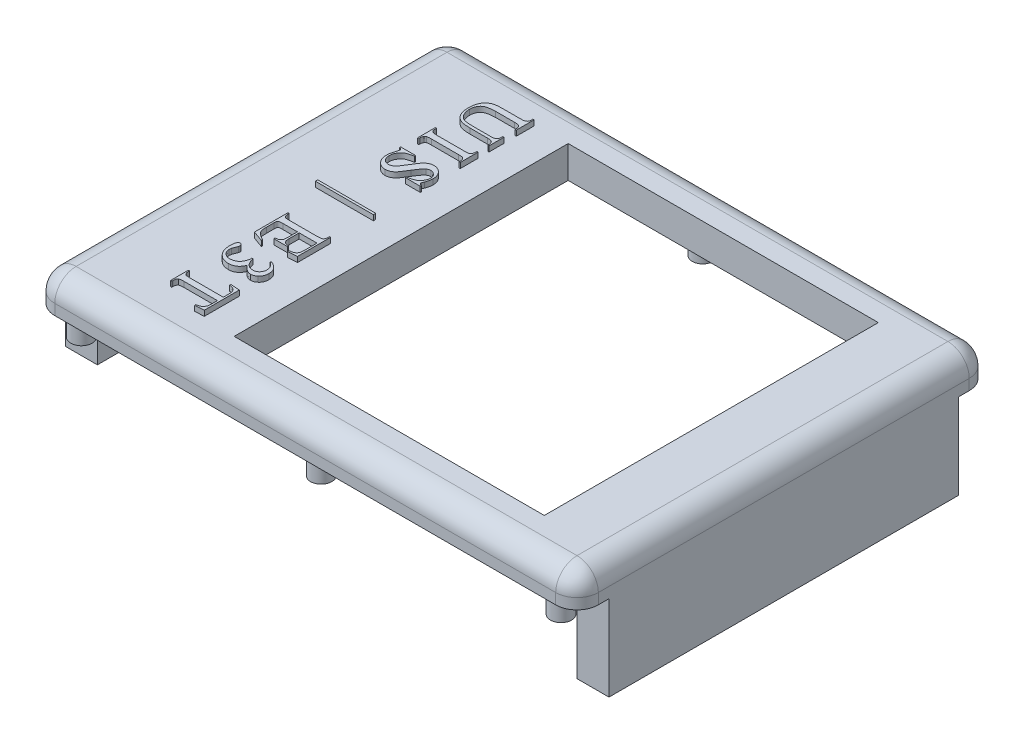
from build123d import *

# Parameters (mm, degrees)
CROQUIS1_W              = 51
CROQUIS1_H              = 38.8
SALIENTE_EXTRUIR1_DEPTH = 3
CROQUIS2_R              = 0.99
SALIENTE_EXTRUIR2_DEPTH = 2
CROQUIS5_W              = 29.1
CROQUIS5_H              = 31.34
CORTAR_EXTRUIR1_DEPTH   = 6
REDONDEO1_R             = 2
REDONDEO2_R             = 2
CROQUIS7_W              = 3
CROQUIS7_H              = 32.8
SALIENTE_EXTRUIR5_DEPTH = 8
CROQUIS9_W              = 3
CROQUIS9_H              = 32.8
SALIENTE_EXTRUIR6_DEPTH = 5
CROQUIS6_W              = 5.444444445
CROQUIS6_H              = 0.222222223
SALIENTE_EXTRUIR7_DEPTH = 0.5


with BuildPart() as part:
    # Croquis1 → Saliente-Extruir1 (new body)
    with BuildSketch(Plane(origin=(0, 0, 0), x_dir=(1, 0, 0), z_dir=(0, 1, 0))):
        with Locations((1.724460432, -10.851079137)):
            Rectangle(CROQUIS1_W, CROQUIS1_H)
    extrude(amount=SALIENTE_EXTRUIR1_DEPTH)

    # Croquis2 → Saliente-Extruir2 (add)
    with BuildSketch(Plane.XZ):
        with Locations(Location((-20.775539568, 28.751079137, 0), (0, 0, 90))):
            Circle(CROQUIS2_R)
        with Locations(Location((1.724460432, 28.751079137, 0), (0, 0, 90))):
            Circle(CROQUIS2_R)
        with Locations(Location((24.224460432, 28.751079137, 0), (0, 0, 90))):
            Circle(CROQUIS2_R)
        with Locations(Location((24.224460432, -7.048920863, 0), (0, 0, 90))):
            Circle(CROQUIS2_R)
        with Locations(Location((1.724460432, -7.048920863, 0), (0, 0, 90))):
            Circle(CROQUIS2_R)
        with Locations(Location((-20.775539568, -7.048920863, 0), (0, 0, 90))):
            Circle(CROQUIS2_R)
    extrude(amount=SALIENTE_EXTRUIR2_DEPTH)

    # Croquis5 → Cortar-Extruir1 (cut)
    with BuildSketch(Plane(origin=(0, 3, 0), x_dir=(1, 0, 0), z_dir=(0, 1, 0))):
        with Locations((5.874460432, -10.851079137)):
            Rectangle(CROQUIS5_W, CROQUIS5_H)
    extrude(amount=-CORTAR_EXTRUIR1_DEPTH, mode=Mode.SUBTRACT)

    # Redondeo1
    redondeo1_edges = [part.edges().sort_by_distance(p)[0] for p in [
        (-23.775539568, 1.5, -8.548920863),
        (27.224460432, 1.5, -8.548920863),
        (27.224460432, 1.5, 30.251079137),
        (-23.775539568, 1.5, 30.251079137),
    ]]
    fillet(redondeo1_edges, radius=REDONDEO1_R)

    # Redondeo2
    redondeo2_edges = [part.edges().sort_by_distance(p)[0] for p in [
        (1.724460432, 3, 30.251079137),
        (-23.775539568, 3, 10.851079137),
        (27.224460432, 3, 10.851079137),
        (1.724460432, 3, -8.548920863),
        (26.638673994, 3, 29.665292699),
        (26.638673994, 3, -7.963134426),
        (-23.189753131, 3, -7.963134426),
        (-23.189753131, 3, 29.665292699),
    ]]
    fillet(redondeo2_edges, radius=REDONDEO2_R)

    # Croquis7 → Saliente-Extruir5 (add)
    with BuildSketch(Plane.XZ):
        with Locations((25.724460432, 10.851079137)):
            Rectangle(CROQUIS7_W, CROQUIS7_H)
    extrude(amount=SALIENTE_EXTRUIR5_DEPTH)

    # Croquis9 → Saliente-Extruir6 (add)
    with BuildSketch(Plane.XZ):
        with Locations((-22.275539568, 10.851079137)):
            Rectangle(CROQUIS9_W, CROQUIS9_H)
    extrude(amount=SALIENTE_EXTRUIR6_DEPTH)

    # Croquis6 → Saliente-Extruir7 (add)
    with BuildSketch(Plane(origin=(0, 3, 0), x_dir=(1, 0, 0), z_dir=(0, 1, 0))):
        with BuildLine():
            Line((-11.812886434, 1.810031974), (-11.701775323, 1.810031974))
            Line((-11.701775323, 1.810031974), (-11.701775323, 0.421143086))
            Line((-11.701775323, 0.421143086), (-11.812886434, 0.421143086))
            Line((-11.812886434, 0.421143086), (-11.812886434, 0.566108363))
            add(Edge.make_bspline(
                [(-11.812886434, 0.566108363), (-11.813186826, 0.584682436), (-11.813773216, 0.620940506), (-11.824160001, 0.673232362), (-11.838466161, 0.722876431), (-11.860424884, 0.768485072), (-11.88776298, 0.811396589), (-11.921928202, 0.849946633), (-11.961236962, 0.886581508), (-11.991662382, 0.906529818), (-12.007330879, 0.916802808)],
                knots=[0, 0, 0, 0, 1.05814492, 2.065583099, 3.032120933, 3.999927837, 4.943619597, 5.927082395, 6.932487944, 8, 8, 8, 8], degree=3))
            add(Edge.make_bspline(
                [(-12.007330879, 0.916802808), (-12.015885945, 0.921702514), (-12.034867297, 0.93257362), (-12.06909909, 0.943881837), (-12.109995222, 0.954191617), (-12.158383141, 0.963121326), (-12.214465465, 0.968208496), (-12.277768335, 0.974063308), (-12.348464256, 0.97615662), (-12.397956625, 0.976511773), (-12.423997545, 0.976698641)],
                knots=[0, 0, 0, 0, 0.555635884, 1.232804023, 2.025528617, 2.939087152, 4.007474232, 5.204479969, 6.529108343, 8, 8, 8, 8], degree=3))
            Line((-12.423997545, 0.976698641), (-14.03250449, 0.976698641))
            add(Edge.make_bspline(
                [(-14.03250449, 0.976698641), (-14.080835984, 0.976897003), (-14.174646751, 0.977282019), (-14.311224421, 0.984109031), (-14.439547124, 0.992038247), (-14.559510076, 1.004822908), (-14.67080696, 1.022773258), (-14.774254396, 1.04176871), (-14.869128773, 1.066579748), (-14.957232907, 1.093794393), (-15.039253771, 1.128523641), (-15.117531157, 1.169166657), (-15.192513448, 1.217442713), (-15.265011397, 1.272314656), (-15.334309799, 1.334853337), (-15.400323735, 1.404858663), (-15.464121557, 1.48127843), (-15.523537762, 1.565629123), (-15.580129804, 1.656506087), (-15.627247332, 1.756656429), (-15.667491857, 1.864406349), (-15.699946214, 1.979767397), (-15.726445309, 2.102906691), (-15.743890155, 2.234114046), (-15.755741176, 2.373181779), (-15.756791923, 2.46857011), (-15.757330879, 2.517497252)],
                knots=[0, 0, 0, 0, 1.298907791, 2.52116217, 3.674831977, 4.754425565, 5.762003026, 6.704633784, 7.579886174, 8.39646913, 9.180785329, 9.970443218, 10.764379056, 11.574790616, 12.411857157, 13.270046324, 14.159284991, 15.085081703, 16.041440738, 17.032860088, 18.054181196, 19.12995817, 20.251108708, 21.436788606, 22.685262574, 24, 24, 24, 24], degree=3))
            add(Edge.make_bspline(
                [(-15.757330879, 2.517497252), (-15.75670387, 2.570466795), (-15.75548625, 2.673331021), (-15.744993583, 2.822558123), (-15.727924096, 2.962009634), (-15.703658724, 3.091619749), (-15.673160658, 3.211820068), (-15.633493121, 3.321494422), (-15.589065847, 3.421994145), (-15.536111231, 3.512221723), (-15.477434728, 3.594258131), (-15.413928939, 3.669783907), (-15.346059325, 3.739779783), (-15.272814878, 3.803265939), (-15.194871331, 3.86074066), (-15.111559893, 3.910764931), (-15.024943179, 3.956990929), (-14.963617999, 3.981052238), (-14.932678101, 3.993191697)],
                knots=[0, 0, 0, 0, 1.399579653, 2.717914267, 3.950818895, 5.110036753, 6.200518206, 7.223531918, 8.188553587, 9.099986203, 9.982611596, 10.850979964, 11.705298224, 12.556222305, 13.409581964, 14.260643446, 15.122456467, 16, 16, 16, 16], degree=3))
            add(Edge.make_bspline(
                [(-14.932678101, 3.993191697), (-14.908781507, 4.001138469), (-14.85702154, 4.018351161), (-14.77055747, 4.036552634), (-14.670465641, 4.05151946), (-14.556494723, 4.065810468), (-14.428179272, 4.075782279), (-14.285743758, 4.082352883), (-14.129174745, 4.086751631), (-14.020065562, 4.087446637), (-13.963060045, 4.087809752)],
                knots=[0, 0, 0, 0, 0.617665381, 1.337861774, 2.164475126, 3.101682011, 4.156149986, 5.322177338, 6.600936584, 8, 8, 8, 8], degree=3))
            Line((-13.963060045, 4.087809752), (-12.423997545, 4.087809752))
            add(Edge.make_bspline(
                [(-12.423997545, 4.087809752), (-12.393902201, 4.088203816), (-12.336571878, 4.088954492), (-12.254554348, 4.092906147), (-12.180740282, 4.100949374), (-12.114740981, 4.110637121), (-12.057080981, 4.124764711), (-12.007076859, 4.14077708), (-11.965157761, 4.160430443), (-11.920114073, 4.191123605), (-11.875091729, 4.240301848), (-11.838717671, 4.31443596), (-11.815628814, 4.402122175), (-11.81383855, 4.465540366), (-11.812886434, 4.499268086)],
                knots=[0, 0, 0, 0, 1.264600634, 2.409009288, 3.448162534, 4.38356954, 5.209197542, 5.939652373, 6.586739936, 7.146507456, 8.221936937, 9.341999935, 10.586394876, 12, 12, 12, 12], degree=3))
            Line((-11.812886434, 4.499268086), (-11.812886434, 4.643365308))
            Line((-11.812886434, 4.643365308), (-11.701775323, 4.643365308))
            Line((-11.701775323, 4.643365308), (-11.701775323, 2.976698641))
            Line((-11.701775323, 2.976698641), (-11.812886434, 2.976698641))
            Line((-11.812886434, 2.976698641), (-11.812886434, 3.12340003))
            add(Edge.make_bspline(
                [(-11.812886434, 3.12340003), (-11.813463018, 3.142508077), (-11.814576514, 3.179409449), (-11.820938891, 3.232901798), (-11.834476961, 3.281591402), (-11.85140099, 3.326581905), (-11.874713279, 3.366654004), (-11.901105169, 3.403993402), (-11.934996865, 3.435170201), (-11.959972745, 3.452947649), (-11.972608656, 3.461941697)],
                knots=[0, 0, 0, 0, 1.171077632, 2.261579725, 3.289188532, 4.26020492, 5.196798699, 6.122086454, 7.049917378, 8, 8, 8, 8], degree=3))
            add(Edge.make_bspline(
                [(-11.972608656, 3.461941697), (-11.982580013, 3.467770883), (-12.004273941, 3.480453006), (-12.043309034, 3.493473318), (-12.088868081, 3.505338694), (-12.141840633, 3.516068174), (-12.201912901, 3.523414319), (-12.269419749, 3.52834071), (-12.344095264, 3.532082651), (-12.396503735, 3.532195169), (-12.423997545, 3.532254197)],
                knots=[0, 0, 0, 0, 0.599365068, 1.303993416, 2.129008853, 3.049898852, 4.112078821, 5.274450609, 6.570159807, 8, 8, 8, 8], degree=3))
            Line((-12.423997545, 3.532254197), (-14.186150323, 3.532254197))
            add(Edge.make_bspline(
                [(-14.186150323, 3.532254197), (-14.226668765, 3.53169017), (-14.310956749, 3.53051686), (-14.441586787, 3.522570209), (-14.581052159, 3.50810662), (-14.724771258, 3.489901207), (-14.865275469, 3.467136631), (-14.992386049, 3.43203818), (-15.104109374, 3.390503331), (-15.200307588, 3.337403875), (-15.283405272, 3.273082194), (-15.358737501, 3.198533233), (-15.423831093, 3.109759078), (-15.483539662, 3.010833396), (-15.532907015, 2.899321805), (-15.565690697, 2.774495879), (-15.587181451, 2.638321221), (-15.589474507, 2.543339193), (-15.590664212, 2.494059752)],
                knots=[0, 0, 0, 0, 0.967473696, 2.012575106, 3.123518964, 4.3146852, 5.472133772, 6.518011343, 7.458490451, 8.312073185, 9.130133735, 9.960644692, 10.833935845, 11.751030991, 12.716306638, 13.733705286, 14.824180354, 16, 16, 16, 16], degree=3))
            add(Edge.make_bspline(
                [(-15.590664212, 2.494059752), (-15.588935587, 2.430238763), (-15.585548041, 2.305170273), (-15.550843602, 2.123064547), (-15.497792044, 1.950806443), (-15.434113707, 1.816899308), (-15.374492168, 1.717775601), (-15.326105541, 1.649735536), (-15.276399659, 1.586729079), (-15.221719811, 1.531021848), (-15.165033333, 1.480443201), (-15.104294963, 1.43716779), (-15.041993912, 1.398128943), (-14.974119322, 1.366706609), (-14.899485948, 1.338764947), (-14.813692281, 1.317295062), (-14.716821517, 1.296878448), (-14.607938727, 1.282296817), (-14.487912033, 1.268643185), (-14.356086034, 1.260724776), (-14.212527878, 1.255329794), (-14.112950451, 1.254768437), (-14.061150323, 1.254476419)],
                knots=[0, 0, 0, 0, 1.676960123, 3.286299276, 4.85821677, 6.407340885, 7.172260227, 7.898684432, 8.602383884, 9.280595474, 9.949345183, 10.597909685, 11.240146138, 11.880214089, 12.561706302, 13.333411656, 14.20365876, 15.164876295, 16.221412891, 17.380821135, 18.637504446, 20, 20, 20, 20], degree=3))
            Line((-14.061150323, 1.254476419), (-12.423997545, 1.254476419))
            add(Edge.make_bspline(
                [(-12.423997545, 1.254476419), (-12.393606064, 1.254435655), (-12.335969744, 1.254358348), (-12.253795598, 1.259335276), (-12.180458704, 1.264783183), (-12.116093404, 1.273293016), (-12.060572326, 1.284385536), (-12.014244927, 1.298206252), (-11.975278186, 1.312798363), (-11.955014221, 1.327554278), (-11.945698934, 1.33433753)],
                knots=[0, 0, 0, 0, 1.484107705, 2.814555366, 4.019988359, 5.075390106, 5.984573864, 6.780592097, 7.4394417, 8, 8, 8, 8], degree=3))
            add(Edge.make_bspline(
                [(-11.945698934, 1.33433753), (-11.925160043, 1.354244263), (-11.883871014, 1.394262474), (-11.841804157, 1.473183458), (-11.817547656, 1.564950075), (-11.814497191, 1.630469849), (-11.812886434, 1.665066697)],
                knots=[0, 0, 0, 0, 0.928124107, 1.865794122, 2.873060895, 4, 4, 4, 4], degree=3))
            Line((-11.812886434, 1.665066697), (-11.812886434, 1.810031974))
        make_face()
        with BuildLine():
            Line((-15.590664212, -2.278856914), (-15.701775323, -2.278856914))
            Line((-15.701775323, -2.278856914), (-15.701775323, -0.612190248))
            Line((-15.701775323, -0.612190248), (-15.590664212, -0.612190248))
            Line((-15.590664212, -0.612190248), (-15.590664212, -0.749343026))
            add(Edge.make_bspline(
                [(-15.590664212, -0.749343026), (-15.589063181, -0.78690475), (-15.586045477, -0.857703007), (-15.557520268, -0.955705429), (-15.51206225, -1.039592459), (-15.465868711, -1.079496343), (-15.443094767, -1.099169414)],
                knots=[0, 0, 0, 0, 1.142072474, 2.152636554, 3.089228675, 4, 4, 4, 4], degree=3))
            add(Edge.make_bspline(
                [(-15.443094767, -1.099169414), (-15.433708301, -1.104988365), (-15.413243006, -1.117675412), (-15.37575995, -1.131013792), (-15.330312737, -1.141917676), (-15.276350524, -1.151239207), (-15.21409938, -1.159093775), (-15.143380714, -1.163799677), (-15.064374111, -1.167591994), (-15.008783422, -1.167692799), (-14.979553101, -1.167745803)],
                knots=[0, 0, 0, 0, 0.558477324, 1.217647012, 2.003767936, 2.927281204, 3.991475019, 5.182702724, 6.518627757, 8, 8, 8, 8], degree=3))
            Line((-14.979553101, -1.167745803), (-12.423997545, -1.167745803))
            add(Edge.make_bspline(
                [(-12.423997545, -1.167745803), (-12.399401028, -1.16753647), (-12.352227734, -1.167134992), (-12.284517706, -1.165290643), (-12.22311835, -1.163128637), (-12.168430676, -1.158621809), (-12.120658025, -1.153504469), (-12.079418945, -1.147742315), (-12.044605231, -1.140072808), (-12.023786022, -1.133446477), (-12.014275323, -1.130419414)],
                knots=[0, 0, 0, 0, 1.429813016, 2.742217149, 3.937514499, 5.000517028, 5.931114638, 6.730382289, 7.42000908, 8, 8, 8, 8], degree=3))
            add(Edge.make_bspline(
                [(-12.014275323, -1.130419414), (-12.001838149, -1.12482765), (-11.976740194, -1.113543585), (-11.943171747, -1.086835184), (-11.911512072, -1.053781979), (-11.894063383, -1.027159533), (-11.884935045, -1.013231914)],
                knots=[0, 0, 0, 0, 0.918337523, 1.853185807, 2.876887247, 4, 4, 4, 4], degree=3))
            add(Edge.make_bspline(
                [(-11.884935045, -1.013231914), (-11.873906325, -0.99237502), (-11.851993836, -0.950935354), (-11.830287295, -0.884934703), (-11.814993344, -0.817749656), (-11.813593178, -0.772289414), (-11.812886434, -0.749343026)],
                knots=[0, 0, 0, 0, 1.022081657, 2.030730122, 3.00599665, 4, 4, 4, 4], degree=3))
            Line((-11.812886434, -0.749343026), (-11.812886434, -0.612190248))
            Line((-11.812886434, -0.612190248), (-11.701775323, -0.612190248))
            Line((-11.701775323, -0.612190248), (-11.701775323, -2.278856914))
            Line((-11.701775323, -2.278856914), (-11.812886434, -2.278856914))
            Line((-11.812886434, -2.278856914), (-11.812886434, -2.13909997))
            add(Edge.make_bspline(
                [(-11.812886434, -2.13909997), (-11.814623781, -2.102167354), (-11.817892482, -2.032681135), (-11.844659865, -1.935609651), (-11.892225937, -1.854087171), (-11.937837425, -1.814241256), (-11.960455879, -1.794481914)],
                knots=[0, 0, 0, 0, 1.13807004, 2.141201847, 3.078233522, 4, 4, 4, 4], degree=3))
            add(Edge.make_bspline(
                [(-11.960455879, -1.794481914), (-11.969865278, -1.788718388), (-11.990470921, -1.776096841), (-12.027679718, -1.761619015), (-12.073223665, -1.750076901), (-12.127026916, -1.739211559), (-12.189588981, -1.733541354), (-12.260099371, -1.726746871), (-12.339190532, -1.723603208), (-12.394772048, -1.72340538), (-12.423997545, -1.723301359)],
                knots=[0, 0, 0, 0, 0.557698212, 1.221303328, 2.010007703, 2.934903542, 3.995895676, 5.186633038, 6.520694369, 8, 8, 8, 8], degree=3))
            Line((-12.423997545, -1.723301359), (-14.979553101, -1.723301359))
            add(Edge.make_bspline(
                [(-14.979553101, -1.723301359), (-15.004149741, -1.723509263), (-15.051323273, -1.723907998), (-15.119031681, -1.725771066), (-15.18014803, -1.727861667), (-15.234819465, -1.732540871), (-15.282610703, -1.737472896), (-15.324131045, -1.743311166), (-15.35894554, -1.750973145), (-15.379764663, -1.757600306), (-15.389275323, -1.760627748)],
                knots=[0, 0, 0, 0, 1.429820858, 2.742232189, 3.937536094, 4.983777767, 5.931103291, 6.730375326, 7.420005899, 8, 8, 8, 8], degree=3))
            add(Edge.make_bspline(
                [(-15.389275323, -1.760627748), (-15.401694107, -1.766236835), (-15.426754953, -1.777555856), (-15.460952791, -1.80425406), (-15.491713719, -1.839073798), (-15.509414798, -1.866278662), (-15.518615601, -1.880419414)],
                knots=[0, 0, 0, 0, 0.908166185, 1.83266026, 2.873443546, 4, 4, 4, 4], degree=3))
            add(Edge.make_bspline(
                [(-15.518615601, -1.880419414), (-15.5296372, -1.900692411), (-15.551518325, -1.940940291), (-15.573393411, -2.005477126), (-15.588538829, -2.071557836), (-15.589951274, -2.116443655), (-15.590664212, -2.13909997)],
                knots=[0, 0, 0, 0, 1.017684848, 2.020404712, 3.000790585, 4, 4, 4, 4], degree=3))
            Line((-15.590664212, -2.13909997), (-15.590664212, -2.278856914))
        make_face()
        with BuildLine():
            Line((-11.646219767, -6.089968026), (-13.035108656, -6.089968026))
            Line((-13.035108656, -6.089968026), (-13.035108656, -5.978856914))
            add(Edge.make_bspline(
                [(-13.035108656, -5.978856914), (-12.967846536, -5.969869021), (-12.839878016, -5.952769241), (-12.659338495, -5.915199317), (-12.500529127, -5.867001413), (-12.361144714, -5.808592138), (-12.239299372, -5.737485081), (-12.132231567, -5.652942079), (-12.037590758, -5.556262355), (-11.958090794, -5.44686237), (-11.894780785, -5.329760833), (-11.8464991, -5.209560505), (-11.818947868, -5.086285746), (-11.814902356, -5.00357801), (-11.812886434, -4.962363859)],
                knots=[0, 0, 0, 0, 1.39142573, 2.647235773, 3.777217868, 4.790166756, 5.739721597, 6.660947591, 7.57997301, 8.505774658, 9.424550985, 10.303925409, 11.154827868, 12, 12, 12, 12], degree=3))
            add(Edge.make_bspline(
                [(-11.812886434, -4.962363859), (-11.813211313, -4.939464032), (-11.813851762, -4.894320469), (-11.824135008, -4.828453185), (-11.838604106, -4.765267605), (-11.859427472, -4.705247819), (-11.886660928, -4.648277758), (-11.919729737, -4.594614104), (-11.958276799, -4.543342403), (-12.017472206, -4.481754623), (-12.097818402, -4.414469735), (-12.204446389, -4.354998769), (-12.318627861, -4.318344964), (-12.397404029, -4.314249662), (-12.437018379, -4.312190248)],
                knots=[0, 0, 0, 0, 0.823190787, 1.622796809, 2.393120433, 3.153812862, 3.903666924, 4.660859271, 5.418910275, 6.207043985, 7.730921109, 9.171105095, 10.577427236, 12, 12, 12, 12], degree=3))
            add(Edge.make_bspline(
                [(-12.437018379, -4.312190248), (-12.467561857, -4.313350677), (-12.52772166, -4.315636309), (-12.615333157, -4.339269485), (-12.699773256, -4.373839487), (-12.750085125, -4.40898035), (-12.775560045, -4.426773581)],
                knots=[0, 0, 0, 0, 1.005601748, 1.980678245, 2.977536257, 4, 4, 4, 4], degree=3))
            add(Edge.make_bspline(
                [(-12.775560045, -4.426773581), (-12.795239537, -4.442648872), (-12.838026758, -4.477164985), (-12.900724207, -4.540739255), (-12.969637588, -4.616818102), (-13.040962666, -4.708917996), (-13.118527036, -4.814071395), (-13.200542677, -4.93376974), (-13.28738518, -5.067484999), (-13.345238258, -5.162159426), (-13.375386434, -5.211495803)],
                knots=[0, 0, 0, 0, 0.611101905, 1.328659962, 2.156268474, 3.09294578, 4.144138902, 5.3166236, 6.60164907, 8, 8, 8, 8], degree=3))
            add(Edge.make_bspline(
                [(-13.375386434, -5.211495803), (-13.39993675, -5.252032226), (-13.447367547, -5.330347914), (-13.516604281, -5.443038276), (-13.58157127, -5.546435807), (-13.642673546, -5.64007475), (-13.698115633, -5.725408273), (-13.748992452, -5.801753744), (-13.795950374, -5.868353181), (-13.850791286, -5.94467664), (-13.919316494, -6.028828321), (-14.009833046, -6.116497051), (-14.10724041, -6.192349523), (-14.211138128, -6.25573828), (-14.319935228, -6.305393907), (-14.431796685, -6.341110057), (-14.54632806, -6.364023975), (-14.623833482, -6.366502494), (-14.662712823, -6.367745803)],
                knots=[0, 0, 0, 0, 1.248564963, 2.412206562, 3.484516376, 4.465640353, 5.357921181, 6.165592113, 6.882544305, 7.504670364, 8.641790332, 9.736174339, 10.817308786, 11.888072917, 12.935378102, 13.959992044, 14.976663013, 16, 16, 16, 16], degree=3))
            add(Edge.make_bspline(
                [(-14.662712823, -6.367745803), (-14.699527725, -6.366857645), (-14.772094558, -6.365106974), (-14.878546823, -6.347853509), (-14.980955226, -6.32094912), (-15.079543103, -6.283296716), (-15.174881643, -6.235367153), (-15.266015472, -6.175968633), (-15.353416117, -6.106102981), (-15.435268688, -6.025700013), (-15.510024129, -5.936922379), (-15.577059246, -5.841927382), (-15.632367842, -5.739637538), (-15.678587607, -5.631931695), (-15.714501782, -5.517972786), (-15.739381666, -5.397867085), (-15.754267305, -5.271477206), (-15.756295794, -5.185205472), (-15.757330879, -5.141183303)],
                knots=[0, 0, 0, 0, 0.963147794, 1.898486258, 2.815390311, 3.731292419, 4.656172952, 5.603823843, 6.573947296, 7.581047086, 8.602405402, 9.609020728, 10.619278069, 11.640833019, 12.673450854, 13.741688496, 14.847643762, 16, 16, 16, 16], degree=3))
            add(Edge.make_bspline(
                [(-15.757330879, -5.141183303), (-15.756145175, -5.086402284), (-15.753835287, -4.979682497), (-15.738669938, -4.874027477), (-15.731289212, -4.822606914)],
                knots=[0, 0, 0, 0, 1.026632861, 2, 2, 2, 2], degree=3))
            add(Edge.make_bspline(
                [(-15.731289212, -4.822606914), (-15.729569602, -4.81421241), (-15.725708582, -4.795364334), (-15.718854133, -4.764018111), (-15.709174133, -4.726707254), (-15.696927552, -4.683697883), (-15.682957464, -4.634447403), (-15.666679049, -4.579400173), (-15.647363477, -4.518409129), (-15.626336194, -4.453658027), (-15.604860817, -4.389134464), (-15.587000199, -4.32844883), (-15.571196741, -4.274392082), (-15.557978766, -4.227050981), (-15.548405968, -4.185868852), (-15.541381528, -4.151150197), (-15.536700367, -4.122778819), (-15.535586531, -4.105893128), (-15.535108656, -4.098648581)],
                knots=[0, 0, 0, 0, 0.54761179, 1.229545953, 2.05028691, 3.010423316, 4.087386644, 5.321895787, 6.678726042, 8.175741249, 9.672756456, 11.024157601, 12.217972098, 13.272151859, 14.164739674, 14.919049308, 15.53623463, 16, 16, 16, 16], degree=3))
            add(Edge.make_bspline(
                [(-15.535108656, -4.098648581), (-15.535579966, -4.08732319), (-15.536486721, -4.065534248), (-15.544261643, -4.034305521), (-15.558395688, -4.007152117), (-15.578431967, -3.982747715), (-15.6083342, -3.963712361), (-15.647470224, -3.945844127), (-15.698735676, -3.933224614), (-15.73674892, -3.926786969), (-15.757330879, -3.923301359)],
                knots=[0, 0, 0, 0, 0.858084681, 1.650870771, 2.416167262, 3.163326943, 4.015220049, 5.07550074, 6.416553863, 8, 8, 8, 8], degree=3))
            Line((-15.757330879, -3.923301359), (-15.757330879, -3.812190248))
            Line((-15.757330879, -3.812190248), (-14.36844199, -3.812190248))
            Line((-14.36844199, -3.812190248), (-14.36844199, -3.923301359))
            add(Edge.make_bspline(
                [(-14.36844199, -3.923301359), (-14.405817035, -3.929405302), (-14.478143462, -3.941217365), (-14.582450565, -3.96265606), (-14.679796237, -3.983407579), (-14.76923535, -4.008390012), (-14.851990766, -4.033095413), (-14.927603816, -4.060039337), (-14.996208657, -4.088292337), (-15.077280248, -4.1288736), (-15.170825832, -4.187773265), (-15.271648936, -4.275281372), (-15.362658534, -4.379166511), (-15.442569973, -4.497053481), (-15.508393847, -4.626027415), (-15.555539537, -4.763349231), (-15.58540369, -4.906678225), (-15.588896724, -5.00475203), (-15.590664212, -5.054377748)],
                knots=[0, 0, 0, 0, 0.984182084, 1.904542815, 2.767594021, 3.570341986, 4.31735939, 5.011959232, 5.655849932, 6.244440382, 7.36692079, 8.518747489, 9.701680121, 10.946991771, 12.211638285, 13.453174393, 14.711296577, 16, 16, 16, 16], degree=3))
            add(Edge.make_bspline(
                [(-15.590664212, -5.054377748), (-15.589863756, -5.082751157), (-15.588299942, -5.138183035), (-15.57999996, -5.219314275), (-15.564231811, -5.295979319), (-15.542480823, -5.367922382), (-15.515784507, -5.435801569), (-15.481473183, -5.498390316), (-15.441730024, -5.556905811), (-15.395392125, -5.60959063), (-15.345702718, -5.656996831), (-15.292745108, -5.698007362), (-15.238650067, -5.734415012), (-15.180450645, -5.761471271), (-15.12162986, -5.784832371), (-15.060028698, -5.800191089), (-14.996368341, -5.810106886), (-14.952970862, -5.811488786), (-14.93094199, -5.812190248)],
                knots=[0, 0, 0, 0, 1.212040469, 2.367909939, 3.477883232, 4.549069953, 5.57481445, 6.586694365, 7.591000223, 8.589587838, 9.577335541, 10.519182355, 11.448049943, 12.354451666, 13.254089103, 14.147253018, 15.05953235, 16, 16, 16, 16], degree=3))
            add(Edge.make_bspline(
                [(-14.93094199, -5.812190248), (-14.905968231, -5.811524736), (-14.85558038, -5.810181977), (-14.780532782, -5.793612307), (-14.704348652, -5.771947591), (-14.628954522, -5.7381511), (-14.5539682, -5.695920237), (-14.482059671, -5.642501443), (-14.412621753, -5.579307611), (-14.370309537, -5.531370121), (-14.348476712, -5.506634692)],
                knots=[0, 0, 0, 0, 0.880861666, 1.777254614, 2.705733056, 3.676491508, 4.688590632, 5.741847226, 6.83480806, 8, 8, 8, 8], degree=3))
            add(Edge.make_bspline(
                [(-14.348476712, -5.506634692), (-14.339987577, -5.496002353), (-14.320372663, -5.471435374), (-14.289559486, -5.427473745), (-14.251132359, -5.373339019), (-14.208120248, -5.306889334), (-14.158284166, -5.22956841), (-14.103369092, -5.140330372), (-14.04136703, -5.04044343), (-13.975628003, -4.931904477), (-13.908155371, -4.821695886), (-13.843148923, -4.715079737), (-13.780565301, -4.616823508), (-13.72252521, -4.524933932), (-13.666993998, -4.441376617), (-13.615688289, -4.364561378), (-13.568160029, -4.295248482), (-13.510054049, -4.213703498), (-13.437292672, -4.122968423), (-13.346918334, -4.025248014), (-13.249227542, -3.944319567), (-13.148607075, -3.875785479), (-13.042453316, -3.821605425), (-12.930554212, -3.784743527), (-12.813873781, -3.761092194), (-12.734297377, -3.758134066), (-12.693962823, -3.756634692)],
                knots=[0, 0, 0, 0, 0.389670496, 0.900368887, 1.537327681, 2.291397621, 3.167445765, 4.172602766, 5.292873819, 6.535337192, 7.807662738, 8.994725359, 10.112356069, 11.144792405, 12.10806384, 12.986266124, 13.790981069, 14.515592038, 15.854128484, 17.120635582, 18.320965422, 19.479645839, 20.602856919, 21.722115554, 22.845418386, 24, 24, 24, 24], degree=3))
            add(Edge.make_bspline(
                [(-12.693962823, -3.756634692), (-12.658900145, -3.757683502), (-12.589619912, -3.759755841), (-12.487465827, -3.774811394), (-12.388983283, -3.799770726), (-12.294692566, -3.836013817), (-12.203669516, -3.881169348), (-12.116849433, -3.937365361), (-12.032935057, -4.002460055), (-11.954770386, -4.078056499), (-11.882015084, -4.160083829), (-11.819491917, -4.249681002), (-11.765017165, -4.343337654), (-11.721500967, -4.44335456), (-11.687606065, -4.54892522), (-11.663339518, -4.659936862), (-11.649498748, -4.776540376), (-11.647329041, -4.855846173), (-11.646219767, -4.896391637)],
                knots=[0, 0, 0, 0, 0.975062147, 1.926622126, 2.865572658, 3.795337113, 4.731177957, 5.686745952, 6.667240611, 7.680517841, 8.707195514, 9.712063125, 10.714348853, 11.716246724, 12.739448301, 13.794013663, 14.87217904, 16, 16, 16, 16], degree=3))
            add(Edge.make_bspline(
                [(-11.646219767, -4.896391637), (-11.648226721, -4.948873556), (-11.652333422, -5.05626398), (-11.681372211, -5.219347638), (-11.729362511, -5.386706492), (-11.774212594, -5.496886993), (-11.797261434, -5.553509692)],
                knots=[0, 0, 0, 0, 0.927627064, 1.898144454, 2.919838524, 4, 4, 4, 4], degree=3))
            add(Edge.make_bspline(
                [(-11.797261434, -5.553509692), (-11.808086507, -5.578245949), (-11.827761139, -5.623204239), (-11.849026289, -5.6863778), (-11.864984751, -5.737067149), (-11.867410027, -5.767844418), (-11.86844199, -5.780940248)],
                knots=[0, 0, 0, 0, 1.351879575, 2.457048934, 3.343469241, 4, 4, 4, 4], degree=3))
            add(Edge.make_bspline(
                [(-11.86844199, -5.780940248), (-11.868080047, -5.792873226), (-11.867380654, -5.815931623), (-11.857999358, -5.848749822), (-11.844458435, -5.87843765), (-11.824240186, -5.905355553), (-11.794863214, -5.928611926), (-11.755031792, -5.947863425), (-11.704545661, -5.965212299), (-11.66686821, -5.974026469), (-11.646219767, -5.978856914)],
                knots=[0, 0, 0, 0, 0.868125657, 1.677501313, 2.471018957, 3.239701785, 4.110392073, 5.177601582, 6.453235832, 8, 8, 8, 8], degree=3))
            Line((-11.646219767, -5.978856914), (-11.646219767, -6.089968026))
        make_face()
        with Locations((-14.257330878, -10.489968026)):
            Rectangle(CROQUIS6_W, CROQUIS6_H)
        with BuildLine():
            Line((-11.86844199, -15.556634692), (-13.535108656, -15.556634692))
            Line((-13.535108656, -15.556634692), (-13.535108656, -16.501079137))
            add(Edge.make_bspline(
                [(-13.535108656, -16.501079137), (-13.534724893, -16.52770536), (-13.533990199, -16.578679758), (-13.529861788, -16.651705888), (-13.522459056, -16.717600817), (-13.510746847, -16.776628053), (-13.497493296, -16.829053895), (-13.481054048, -16.87487257), (-13.461539574, -16.913962814), (-13.444331679, -16.935353534), (-13.436150323, -16.945523581)],
                knots=[0, 0, 0, 0, 1.378536541, 2.639130306, 3.785607632, 4.808023544, 5.752749077, 6.582109099, 7.325875096, 8, 8, 8, 8], degree=3))
            add(Edge.make_bspline(
                [(-13.436150323, -16.945523581), (-13.424685041, -16.957841054), (-13.401473171, -16.982778214), (-13.358129582, -17.012623444), (-13.31092534, -17.041135497), (-13.256103142, -17.062908722), (-13.196070139, -17.082852444), (-13.129077689, -17.095231265), (-13.056631339, -17.107804466), (-13.005945343, -17.110688519), (-12.979553101, -17.112190248)],
                knots=[0, 0, 0, 0, 0.807279986, 1.634366921, 2.520296536, 3.456336839, 4.464656133, 5.55960839, 6.72928595, 8, 8, 8, 8], degree=3))
            Line((-12.979553101, -17.112190248), (-12.979553101, -17.223301359))
            Line((-12.979553101, -17.223301359), (-14.257330879, -17.223301359))
            Line((-14.257330879, -17.223301359), (-14.257330879, -17.112190248))
            add(Edge.make_bspline(
                [(-14.257330879, -17.112190248), (-14.215898167, -17.105835634), (-14.140916746, -17.094335591), (-14.041123595, -17.074960293), (-13.965543658, -17.055456294), (-13.925035621, -17.038454719), (-13.908372545, -17.031461081)],
                knots=[0, 0, 0, 0, 1.400091839, 2.533767946, 3.396862008, 4, 4, 4, 4], degree=3))
            add(Edge.make_bspline(
                [(-13.908372545, -17.031461081), (-13.892563612, -17.022255289), (-13.860773248, -17.003743257), (-13.820939767, -16.963707496), (-13.784587397, -16.917664056), (-13.754710618, -16.860915954), (-13.729909691, -16.792529752), (-13.713506425, -16.708907416), (-13.703425747, -16.610126641), (-13.702349457, -16.539013595), (-13.701775323, -16.501079137)],
                knots=[0, 0, 0, 0, 0.730144536, 1.46825602, 2.245237048, 3.075344244, 4.025392287, 5.151105914, 6.480289368, 8, 8, 8, 8], degree=3))
            Line((-13.701775323, -16.501079137), (-13.701775323, -15.556634692))
            Line((-13.701775323, -15.556634692), (-15.069830879, -15.556634692))
            add(Edge.make_bspline(
                [(-15.069830879, -15.556634692), (-15.091535032, -15.556453417), (-15.132926128, -15.556107715), (-15.191647365, -15.558424881), (-15.243758314, -15.559756156), (-15.288917824, -15.562331207), (-15.327440182, -15.565715818), (-15.359323587, -15.569895945), (-15.384704666, -15.574689492), (-15.419106306, -15.586136032), (-15.462027175, -15.613856118), (-15.498611397, -15.659335456), (-15.51757265, -15.709838593), (-15.528210177, -15.761860598), (-15.533445748, -15.827945003), (-15.534518622, -15.876361751), (-15.535108656, -15.902988859)],
                knots=[0, 0, 0, 0, 1.289467428, 2.459090127, 3.491237006, 4.386754367, 5.146361475, 5.788280873, 6.297434579, 6.678015623, 7.937329462, 9.271857303, 10.066831373, 11.122340958, 12.417412555, 14, 14, 14, 14], degree=3))
            Line((-15.535108656, -15.902988859), (-15.535108656, -16.614794414))
            add(Edge.make_bspline(
                [(-15.535108656, -16.614794414), (-15.534353224, -16.670067432), (-15.532952032, -16.772588942), (-15.52526887, -16.914417509), (-15.510175191, -17.031998439), (-15.488885507, -17.12975833), (-15.45589077, -17.213840923), (-15.411033001, -17.29188486), (-15.356046408, -17.369508966), (-15.31092257, -17.416838858), (-15.287712823, -17.441183303)],
                knots=[0, 0, 0, 0, 1.488116751, 2.760189026, 3.821074914, 4.676996555, 5.446540332, 6.241716068, 7.095614964, 8, 8, 8, 8], degree=3))
            add(Edge.make_bspline(
                [(-15.287712823, -17.441183303), (-15.251852612, -17.474027586), (-15.175028633, -17.544390486), (-15.038990204, -17.640932517), (-14.87991808, -17.740200133), (-14.763262956, -17.801894204), (-14.701775323, -17.83441247)],
                knots=[0, 0, 0, 0, 0.823493647, 1.764185327, 2.821526682, 4, 4, 4, 4], degree=3))
            Line((-14.701775323, -17.83441247), (-14.701775323, -17.945523581))
            Line((-14.701775323, -17.945523581), (-15.701775323, -17.585280526))
            Line((-15.701775323, -17.585280526), (-15.701775323, -14.445523581))
            Line((-15.701775323, -14.445523581), (-15.590664212, -14.445523581))
            Line((-15.590664212, -14.445523581), (-15.590664212, -14.582676359))
            add(Edge.make_bspline(
                [(-15.590664212, -14.582676359), (-15.58982563, -14.605309007), (-15.588145384, -14.650657509), (-15.574648742, -14.717482927), (-15.553060335, -14.782715281), (-15.53192005, -14.823378931), (-15.521219767, -14.843961081)],
                knots=[0, 0, 0, 0, 0.993225946, 1.990103322, 2.982678719, 4, 4, 4, 4], degree=3))
            add(Edge.make_bspline(
                [(-15.521219767, -14.843961081), (-15.512833217, -14.858285457), (-15.496247141, -14.886614765), (-15.461366968, -14.921179706), (-15.421902297, -14.949931166), (-15.372322629, -14.971259823), (-15.307223025, -14.985665493), (-15.220147906, -14.993416754), (-15.108441925, -15.001056474), (-15.025291466, -15.001071095), (-14.979553101, -15.001079137)],
                knots=[0, 0, 0, 0, 0.667369636, 1.319856443, 1.964773053, 2.628864219, 3.481548889, 4.644936573, 6.154488617, 8, 8, 8, 8], degree=3))
            Line((-14.979553101, -15.001079137), (-12.423997545, -15.001079137))
            add(Edge.make_bspline(
                [(-12.423997545, -15.001079137), (-12.392454463, -15.001004896), (-12.332818256, -15.000864535), (-12.24798211, -14.997381066), (-12.172655618, -14.991596944), (-12.106890558, -14.983075761), (-12.050682288, -14.972558793), (-12.003506894, -14.961267701), (-11.965563628, -14.946117276), (-11.945241672, -14.932512618), (-11.936150323, -14.926426359)],
                knots=[0, 0, 0, 0, 1.515860028, 2.865926047, 4.079691609, 5.145686739, 6.051205089, 6.826977126, 7.475229611, 8, 8, 8, 8], degree=3))
            add(Edge.make_bspline(
                [(-11.936150323, -14.926426359), (-11.916991867, -14.907373451), (-11.877051639, -14.867653261), (-11.839184857, -14.786387907), (-11.816611912, -14.689841631), (-11.814189486, -14.620159313), (-11.812886434, -14.582676359)],
                knots=[0, 0, 0, 0, 0.855382921, 1.78324335, 2.807580013, 4, 4, 4, 4], degree=3))
            Line((-11.812886434, -14.582676359), (-11.812886434, -14.445523581))
            Line((-11.812886434, -14.445523581), (-11.701775323, -14.445523581))
            Line((-11.701775323, -14.445523581), (-11.701775323, -17.556634692))
            Line((-11.701775323, -17.556634692), (-12.590664212, -17.612190248))
            Line((-12.590664212, -17.612190248), (-12.590664212, -17.501079137))
            add(Edge.make_bspline(
                [(-12.590664212, -17.501079137), (-12.562873695, -17.495651447), (-12.509517437, -17.485230584), (-12.432946609, -17.469122381), (-12.36338528, -17.451279348), (-12.300232444, -17.434748594), (-12.244334854, -17.415907109), (-12.194735701, -17.398306105), (-12.152205154, -17.37916211), (-12.104422001, -17.353712285), (-12.051565303, -17.317251559), (-11.999137487, -17.261979303), (-11.951157386, -17.200154626), (-11.9286224, -17.152355152), (-11.917053101, -17.127815248)],
                knots=[0, 0, 0, 0, 1.262357314, 2.423656353, 3.487363343, 4.463716575, 5.332580861, 6.116156166, 6.809008151, 7.409208864, 8.529373938, 9.651320115, 10.794204727, 12, 12, 12, 12], degree=3))
            add(Edge.make_bspline(
                [(-11.917053101, -17.127815248), (-11.909104258, -17.103677627), (-11.890970615, -17.048612628), (-11.879175015, -16.950982555), (-11.868884584, -16.831179471), (-11.868597894, -16.743308622), (-11.86844199, -16.695523581)],
                knots=[0, 0, 0, 0, 0.696394265, 1.588679787, 2.688700125, 4, 4, 4, 4], degree=3))
            Line((-11.86844199, -16.695523581), (-11.86844199, -15.556634692))
        make_face()
        with BuildLine():
            add(Edge.make_bspline(
                [(-12.479553101, -19.201079137), (-12.447036065, -19.215596016), (-12.383441234, -19.243987241), (-12.291741273, -19.289804088), (-12.2062159, -19.339820655), (-12.126167587, -19.392157819), (-12.051480946, -19.447283129), (-11.983001885, -19.505250003), (-11.920315355, -19.566389216), (-11.862644038, -19.629719348), (-11.811058165, -19.696304446), (-11.767427061, -19.767591715), (-11.730036119, -19.842544054), (-11.698523005, -19.921320195), (-11.675098744, -20.004598679), (-11.659080156, -20.091517935), (-11.6480308, -20.182280298), (-11.646831641, -20.244158426), (-11.646219767, -20.275731914)],
                knots=[0, 0, 0, 0, 1.176237633, 2.300413653, 3.383997906, 4.447027319, 5.458264624, 6.448321838, 7.408113228, 8.348724641, 9.275885828, 10.1856912, 11.104687767, 12.040039974, 12.983996095, 13.956880559, 14.957492562, 16, 16, 16, 16], degree=3))
            add(Edge.make_bspline(
                [(-11.646219767, -20.275731914), (-11.647349166, -20.314249319), (-11.649556017, -20.38951255), (-11.662946737, -20.499017908), (-11.687669504, -20.601616676), (-11.721206999, -20.697266142), (-11.764758625, -20.786237444), (-11.819643893, -20.86689186), (-11.881506913, -20.943067439), (-11.931115048, -20.985911183), (-11.956115601, -21.007502748)],
                knots=[0, 0, 0, 0, 1.123808988, 2.195929207, 3.211426243, 4.196579678, 5.14788152, 6.09136163, 7.038121192, 8, 8, 8, 8], degree=3))
            add(Edge.make_bspline(
                [(-11.956115601, -21.007502748), (-11.994224115, -21.037335621), (-12.067782894, -21.094920384), (-12.19148941, -21.155262724), (-12.318637554, -21.19409935), (-12.405785964, -21.198759279), (-12.449171156, -21.201079137)],
                knots=[0, 0, 0, 0, 1.071729872, 2.068701529, 3.038539469, 4, 4, 4, 4], degree=3))
            add(Edge.make_bspline(
                [(-12.449171156, -21.201079137), (-12.485490711, -21.19936177), (-12.559323923, -21.195870575), (-12.669822061, -21.168121278), (-12.780864026, -21.124170069), (-12.892506933, -21.062465792), (-13.00479228, -20.983238251), (-13.118427801, -20.88752615), (-13.232467272, -20.773985705), (-13.304799136, -20.6894624), (-13.342400323, -20.645523581)],
                knots=[0, 0, 0, 0, 0.802544778, 1.631475345, 2.504987027, 3.438672434, 4.445331875, 5.540090885, 6.721234327, 8, 8, 8, 8], degree=3))
            add(Edge.make_bspline(
                [(-13.342400323, -20.645523581), (-13.354416601, -20.674650508), (-13.377985903, -20.731781453), (-13.420061155, -20.81290248), (-13.466277268, -20.888131379), (-13.514770124, -20.959151663), (-13.567631187, -21.024445725), (-13.625324809, -21.083482539), (-13.686216993, -21.137481723), (-13.750378942, -21.186375493), (-13.818603059, -21.22889932), (-13.889582061, -21.266297856), (-13.963628542, -21.297660067), (-14.040652878, -21.322863561), (-14.120465649, -21.342685568), (-14.203057766, -21.357585762), (-14.288672054, -21.366500733), (-14.346719271, -21.367325931), (-14.37625449, -21.367745803)],
                knots=[0, 0, 0, 0, 1.121354654, 2.199478579, 3.248921864, 4.263348953, 5.259247339, 6.235450722, 7.198741082, 8.154732846, 9.103649488, 10.05747416, 11.008401694, 11.962893688, 12.939803421, 13.933995404, 14.94878857, 16, 16, 16, 16], degree=3))
            add(Edge.make_bspline(
                [(-14.37625449, -21.367745803), (-14.418544176, -21.36671534), (-14.501649037, -21.364690344), (-14.624236657, -21.349550686), (-14.742330388, -21.324789996), (-14.855948655, -21.288468666), (-14.965791395, -21.243616974), (-15.071175541, -21.187592124), (-15.172345779, -21.121647091), (-15.23519207, -21.070578287), (-15.26687949, -21.044829137)],
                knots=[0, 0, 0, 0, 1.048019005, 2.059496798, 3.056839529, 4.034491814, 5.012117791, 5.993865523, 6.98849678, 8, 8, 8, 8], degree=3))
            add(Edge.make_bspline(
                [(-15.26687949, -21.044829137), (-15.306043163, -21.00872687), (-15.384127065, -20.936746752), (-15.483833711, -20.812156803), (-15.56884567, -20.676391983), (-15.638415182, -20.528949775), (-15.692437052, -20.369643654), (-15.730160803, -20.198780096), (-15.752964377, -20.016221568), (-15.755847529, -19.890672674), (-15.757330879, -19.826079137)],
                knots=[0, 0, 0, 0, 0.940890677, 1.875932705, 2.811604621, 3.768405022, 4.752285636, 5.780211889, 6.85794322, 8, 8, 8, 8], degree=3))
            add(Edge.make_bspline(
                [(-15.757330879, -19.826079137), (-15.756965678, -19.7945341), (-15.756265068, -19.734017387), (-15.751871514, -19.647157964), (-15.745299218, -19.568032555), (-15.735249419, -19.496620027), (-15.720920056, -19.433353681), (-15.7062038, -19.377472925), (-15.686976474, -19.329602199), (-15.657869401, -19.278893441), (-15.619058108, -19.22744176), (-15.56884597, -19.181297418), (-15.515827934, -19.150751338), (-15.478444311, -19.147221895), (-15.460455879, -19.145523581)],
                knots=[0, 0, 0, 0, 1.402622338, 2.690822499, 3.866137634, 4.9323809, 5.893888556, 6.749255166, 7.49946131, 8.179289024, 9.344987654, 10.347209683, 11.20470239, 12, 12, 12, 12], degree=3))
            add(Edge.make_bspline(
                [(-15.460455879, -19.145523581), (-15.447343315, -19.146405756), (-15.421409256, -19.148150524), (-15.383457897, -19.160929771), (-15.348753224, -19.183034383), (-15.31813164, -19.212864613), (-15.290613071, -19.2468915), (-15.272099215, -19.286630904), (-15.25866518, -19.328977015), (-15.257781853, -19.35866517), (-15.257330879, -19.373822192)],
                knots=[0, 0, 0, 0, 0.930938581, 1.841212573, 2.811072703, 3.829205276, 4.869721576, 5.899620085, 6.927669767, 8, 8, 8, 8], degree=3))
            add(Edge.make_bspline(
                [(-15.257330879, -19.373822192), (-15.257976716, -19.397942114), (-15.259295832, -19.447206756), (-15.270638694, -19.495173337), (-15.276428101, -19.519655526)],
                knots=[0, 0, 0, 0, 0.9791981, 2, 2, 2, 2], degree=3))
            add(Edge.make_bspline(
                [(-15.276428101, -19.519655526), (-15.279824911, -19.530386902), (-15.288250462, -19.557005326), (-15.306004768, -19.604296746), (-15.332442305, -19.666533677), (-15.364185919, -19.739522962), (-15.396481575, -19.813463109), (-15.42239405, -19.879220921), (-15.441528387, -19.93176419), (-15.449912755, -19.962892202), (-15.453511434, -19.976252748)],
                knots=[0, 0, 0, 0, 0.551098561, 1.366961252, 2.47206847, 3.861764831, 5.264472469, 6.422097681, 7.322743916, 8, 8, 8, 8], degree=3))
            add(Edge.make_bspline(
                [(-15.453511434, -19.976252748), (-15.460892192, -20.012302506), (-15.47607923, -20.086480391), (-15.478373714, -20.162172622), (-15.479553101, -20.201079137)],
                knots=[0, 0, 0, 0, 0.971981303, 2, 2, 2, 2], degree=3))
            add(Edge.make_bspline(
                [(-15.479553101, -20.201079137), (-15.479038141, -20.225156291), (-15.478027023, -20.272431539), (-15.465419281, -20.341985553), (-15.449107674, -20.409605782), (-15.423162459, -20.474703269), (-15.390261533, -20.536781311), (-15.350323975, -20.596870841), (-15.303881721, -20.654734843), (-15.25000067, -20.708962284), (-15.191844874, -20.758918198), (-15.129704065, -20.802417339), (-15.065480546, -20.840113729), (-14.998268617, -20.870589484), (-14.928486777, -20.894255805), (-14.855983247, -20.91038586), (-14.781105076, -20.921437605), (-14.730172466, -20.922674817), (-14.70437949, -20.923301359)],
                knots=[0, 0, 0, 0, 0.983065313, 1.930238827, 2.882863958, 3.823141296, 4.786286532, 5.750956364, 6.768992192, 7.814697814, 8.872049736, 9.899391636, 10.91191335, 11.912546758, 12.911430256, 13.918755074, 14.946028855, 16, 16, 16, 16], degree=3))
            add(Edge.make_bspline(
                [(-14.70437949, -20.923301359), (-14.666102085, -20.922173052), (-14.589692135, -20.919920709), (-14.476420985, -20.900429684), (-14.363929606, -20.871777701), (-14.292035318, -20.842026814), (-14.255594767, -20.826947192)],
                knots=[0, 0, 0, 0, 0.993065039, 1.982371906, 2.977339071, 4, 4, 4, 4], degree=3))
            add(Edge.make_bspline(
                [(-14.255594767, -20.826947192), (-14.229970833, -20.814822986), (-14.181145298, -20.791720723), (-14.113636785, -20.753622249), (-14.056059434, -20.713409277), (-14.023531684, -20.683200654), (-14.008198934, -20.668961081)],
                knots=[0, 0, 0, 0, 1.152609719, 2.196258617, 3.1497624, 4, 4, 4, 4], degree=3))
            add(Edge.make_bspline(
                [(-14.008198934, -20.668961081), (-13.988594692, -20.647967885), (-13.947592941, -20.604061176), (-13.894156598, -20.527203673), (-13.842260142, -20.440321458), (-13.794861131, -20.344015219), (-13.753052832, -20.241815145), (-13.723366172, -20.135850982), (-13.705576556, -20.028940117), (-13.703037564, -19.957220232), (-13.701775323, -19.921565248)],
                knots=[0, 0, 0, 0, 0.833693903, 1.743648582, 2.712634417, 3.772992441, 4.859658072, 5.91640988, 6.964159315, 8, 8, 8, 8], degree=3))
            Line((-13.701775323, -19.921565248), (-13.701775323, -19.833023581))
            Line((-13.701775323, -19.833023581), (-13.590664212, -19.833023581))
            add(Edge.make_bspline(
                [(-13.590664212, -19.833023581), (-13.584602329, -19.872559857), (-13.572372381, -19.952324945), (-13.537175093, -20.070908334), (-13.48930879, -20.189225866), (-13.430383225, -20.305746939), (-13.361844315, -20.414941708), (-13.283511468, -20.509557914), (-13.199737008, -20.589929243), (-13.107437999, -20.651488487), (-13.010145981, -20.699118113), (-12.907723957, -20.731830517), (-12.800991336, -20.752614957), (-12.72820232, -20.755283802), (-12.691358656, -20.756634692)],
                knots=[0, 0, 0, 0, 1.018612419, 2.055067331, 3.143945576, 4.268777657, 5.379813566, 6.422417737, 7.393005108, 8.327904181, 9.238363576, 10.145710484, 11.061413063, 12, 12, 12, 12], degree=3))
            add(Edge.make_bspline(
                [(-12.691358656, -20.756634692), (-12.66759107, -20.756310978), (-12.620719992, -20.755672595), (-12.552554372, -20.745403871), (-12.487162853, -20.731153224), (-12.425990576, -20.709167052), (-12.367923746, -20.682223865), (-12.313423102, -20.648780883), (-12.262647233, -20.609000322), (-12.215518066, -20.563629221), (-12.173459782, -20.513794338), (-12.13684338, -20.460407075), (-12.10525658, -20.404440432), (-12.078993954, -20.345263721), (-12.059230919, -20.28290271), (-12.045424804, -20.217759428), (-12.036276551, -20.149835431), (-12.035503433, -20.10330911), (-12.035108656, -20.079551359)],
                knots=[0, 0, 0, 0, 1.077751702, 2.125389701, 3.122662712, 4.111335761, 5.069076012, 6.024200838, 7.006835464, 7.991487011, 8.988760022, 9.961513352, 10.925984748, 11.902190236, 12.894955384, 13.889370005, 14.922248298, 16, 16, 16, 16], degree=3))
            add(Edge.make_bspline(
                [(-12.035108656, -20.079551359), (-12.036667378, -20.041258767), (-12.039741798, -19.965730523), (-12.062519781, -19.854817805), (-12.10283732, -19.750013208), (-12.155866923, -19.648592752), (-12.226328314, -19.553217974), (-12.311311991, -19.462308248), (-12.412040063, -19.376722581), (-12.487401202, -19.326200888), (-12.526428101, -19.30003747)],
                knots=[0, 0, 0, 0, 0.952779171, 1.879259996, 2.802179632, 3.739622475, 4.719105832, 5.743236713, 6.831301213, 8, 8, 8, 8], degree=3))
            Line((-12.526428101, -19.30003747), (-12.479553101, -19.201079137))
        make_face()
        with BuildLine():
            Line((-11.701775323, -26.289968026), (-12.551601712, -26.345523581))
            Line((-12.551601712, -26.345523581), (-12.551601712, -26.23441247))
            add(Edge.make_bspline(
                [(-12.551601712, -26.23441247), (-12.513324295, -26.228778832), (-12.442524263, -26.218358542), (-12.345637572, -26.197630922), (-12.265553459, -26.174850879), (-12.220369119, -26.15306763), (-12.200039212, -26.143266637)],
                knots=[0, 0, 0, 0, 1.272003444, 2.352768082, 3.258856713, 4, 4, 4, 4], degree=3))
            add(Edge.make_bspline(
                [(-12.200039212, -26.143266637), (-12.172888969, -26.126961921), (-12.120195263, -26.09531742), (-12.051158902, -26.035731503), (-11.993665486, -25.968636268), (-11.946073456, -25.892884105), (-11.910695465, -25.806530183), (-11.885633462, -25.708715693), (-11.871327131, -25.598838533), (-11.869434361, -25.521492444), (-11.86844199, -25.480940248)],
                knots=[0, 0, 0, 0, 0.969416183, 1.881461263, 2.780998894, 3.669492357, 4.611746315, 5.629348736, 6.757078501, 8, 8, 8, 8], degree=3))
            Line((-11.86844199, -25.480940248), (-11.86844199, -24.901079137))
            Line((-11.86844199, -24.901079137), (-14.979553101, -24.901079137))
            add(Edge.make_bspline(
                [(-14.979553101, -24.901079137), (-15.010232109, -24.90105352), (-15.068443285, -24.901004914), (-15.151219124, -24.905780073), (-15.225028551, -24.911798995), (-15.290122409, -24.918794475), (-15.346165624, -24.930078815), (-15.392820601, -24.943872132), (-15.431474056, -24.958662787), (-15.451971728, -24.972768367), (-15.461323934, -24.979204137)],
                knots=[0, 0, 0, 0, 1.489562092, 2.826335232, 4.024785645, 5.086235066, 6.003918599, 6.795325823, 7.450358981, 8, 8, 8, 8], degree=3))
            add(Edge.make_bspline(
                [(-15.461323934, -24.979204137), (-15.481282665, -24.99944732), (-15.521792967, -25.040534977), (-15.562734408, -25.121458535), (-15.587118676, -25.216185948), (-15.589437221, -25.284302299), (-15.590664212, -25.32034997)],
                knots=[0, 0, 0, 0, 0.902282073, 1.8313649, 2.852342462, 4, 4, 4, 4], degree=3))
            Line((-15.590664212, -25.32034997), (-15.590664212, -25.456634692))
            Line((-15.590664212, -25.456634692), (-15.701775323, -25.456634692))
            Line((-15.701775323, -25.456634692), (-15.701775323, -23.789968026))
            Line((-15.701775323, -23.789968026), (-15.590664212, -23.789968026))
            Line((-15.590664212, -23.789968026), (-15.590664212, -23.928856914))
            add(Edge.make_bspline(
                [(-15.590664212, -23.928856914), (-15.590227639, -23.948856115), (-15.58938253, -23.987570136), (-15.581103488, -24.043288868), (-15.569611426, -24.094765531), (-15.551729483, -24.141605736), (-15.529515751, -24.184254015), (-15.501460253, -24.222122543), (-15.467794727, -24.254546827), (-15.442738311, -24.272886183), (-15.430073934, -24.282155526)],
                knots=[0, 0, 0, 0, 1.182386838, 2.288838982, 3.326958154, 4.296765023, 5.246416275, 6.164047556, 7.072046332, 8, 8, 8, 8], degree=3))
            add(Edge.make_bspline(
                [(-15.430073934, -24.282155526), (-15.4206443, -24.287329655), (-15.399885767, -24.298720058), (-15.3629796, -24.311325378), (-15.31803154, -24.321155273), (-15.265713626, -24.330896698), (-15.205099121, -24.337719848), (-15.136982345, -24.341271026), (-15.060907781, -24.345459316), (-15.007627669, -24.345501404), (-14.979553101, -24.345523581)],
                knots=[0, 0, 0, 0, 0.561580455, 1.236271222, 2.028879402, 2.966584022, 4.017422664, 5.2149421, 6.532486222, 8, 8, 8, 8], degree=3))
            Line((-14.979553101, -24.345523581), (-11.86844199, -24.345523581))
            Line((-11.86844199, -24.345523581), (-11.86844199, -23.862016637))
            add(Edge.make_bspline(
                [(-11.86844199, -23.862016637), (-11.868822795, -23.818590181), (-11.869526759, -23.738311153), (-11.877385359, -23.627952364), (-11.888451404, -23.537162754), (-11.903486477, -23.484873683), (-11.910108656, -23.461843026)],
                knots=[0, 0, 0, 0, 1.290206054, 2.385101079, 3.288719717, 4, 4, 4, 4], degree=3))
            add(Edge.make_bspline(
                [(-11.910108656, -23.461843026), (-11.920528038, -23.436794553), (-11.941608811, -23.386115815), (-11.990149098, -23.317059645), (-12.050561739, -23.253191114), (-12.124207447, -23.195836912), (-12.210650188, -23.145527838), (-12.312325174, -23.108054118), (-12.42703098, -23.079832865), (-12.508898367, -23.071889296), (-12.551601712, -23.067745803)],
                knots=[0, 0, 0, 0, 0.815188302, 1.649310751, 2.524896704, 3.456077657, 4.451846328, 5.525136435, 6.709071402, 8, 8, 8, 8], degree=3))
            Line((-12.551601712, -23.067745803), (-12.551601712, -22.956634692))
            Line((-12.551601712, -22.956634692), (-11.701775323, -23.012190248))
            Line((-11.701775323, -23.012190248), (-11.701775323, -26.289968026))
        make_face()
    extrude(amount=SALIENTE_EXTRUIR7_DEPTH)


solid = part.part
